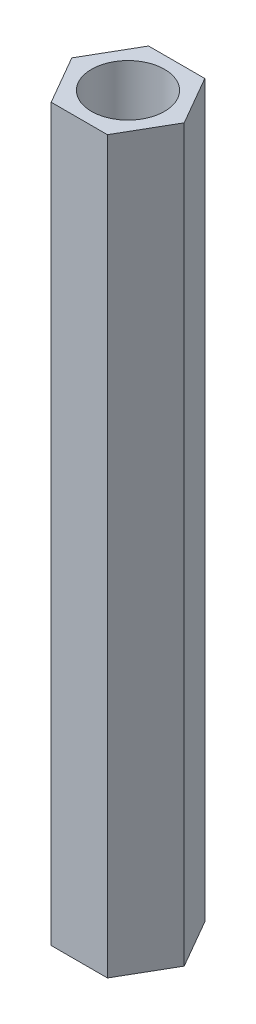
from build123d import *

# Parameters (mm, degrees)
EXTRUDE_1_DEPTH     = 30
SKETCH_2_R          = 1.5
CUT_EXTRUDE_1_DEPTH = 31.155154341


with BuildPart() as part:
    # 草图1 → 凸台-拉伸1 (new body)
    with BuildSketch(Plane(origin=(0, 0, 0), x_dir=(1, 0, 0), z_dir=(0, 1, 0))):
        Polygon((2.309401077, 0), (1.154700538, 2), (-1.154700538, 2), (-2.309401077, 0), (-1.154700538, -2), (1.154700538, -2), align=None)
    extrude(amount=EXTRUDE_1_DEPTH)

    # 草图2 → 切除-拉伸1 (cut, through all)
    with BuildSketch(Plane(origin=(0, 30, 0), x_dir=(1, 0, 0), z_dir=(0, 1, 0))):
        with Locations(Location((0, 0, 0), (0, 0, 270))):
            Circle(SKETCH_2_R)
    extrude(amount=-CUT_EXTRUDE_1_DEPTH, mode=Mode.SUBTRACT)


solid = part.part
